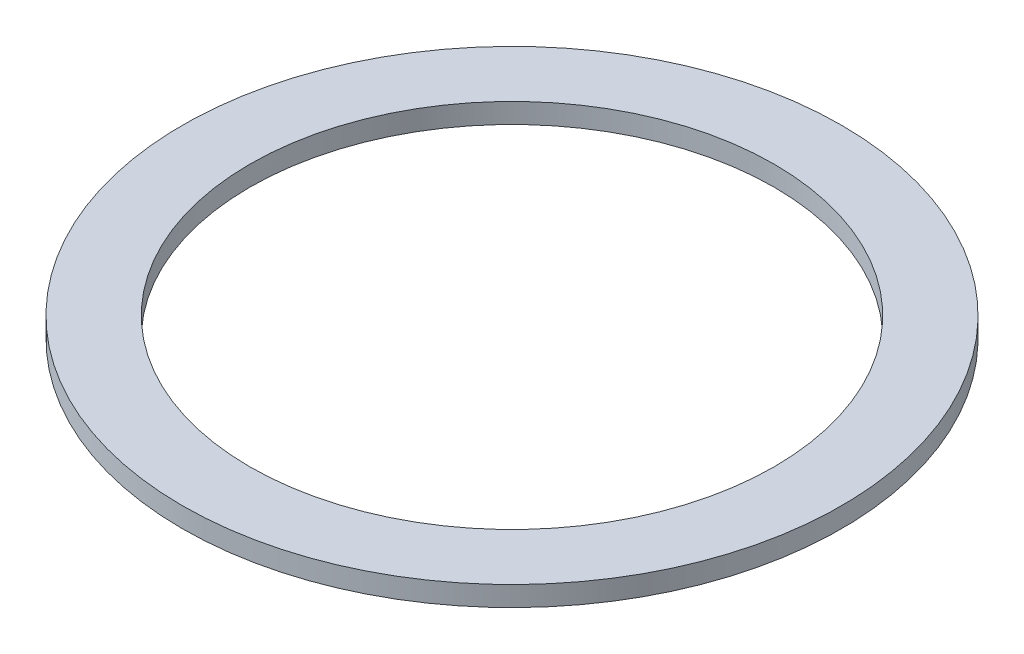
from build123d import *

# Parameters (mm, degrees)
SKETCH1_R           = 33
SKETCH1_R_2         = 26.25
BOSS_EXTRUDE1_DEPTH = 2


with BuildPart() as part:
    # Sketch1 → Boss-Extrude1 (new body)
    with BuildSketch(Plane(origin=(0, 0, 0), x_dir=(1, 0, 0), z_dir=(0, 1, 0))):
        with Locations(Location((0, 0, 0), (0, 0, 270))):
            Circle(SKETCH1_R)
        with Locations(Location((0, 0, 0), (0, 0, 270))):
            Circle(SKETCH1_R_2, mode=Mode.SUBTRACT)
    extrude(amount=BOSS_EXTRUDE1_DEPTH)


solid = part.part
